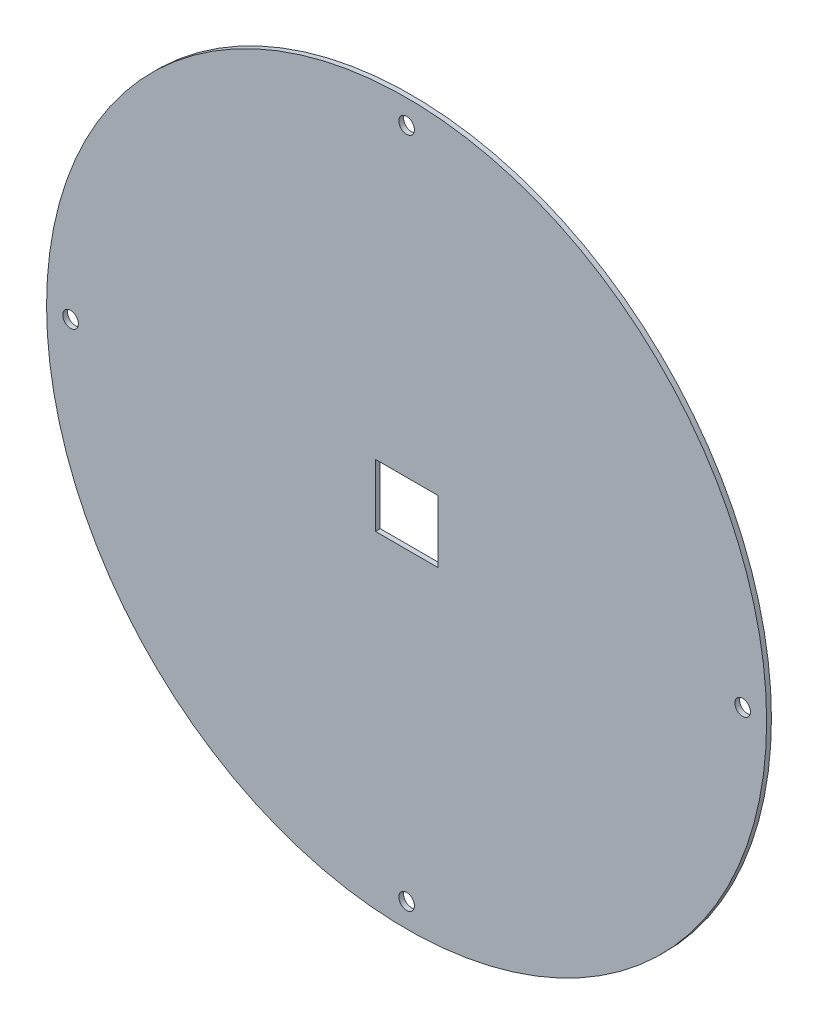
from build123d import *

# Parameters (mm, degrees)
CROQUIS1_R              = 150
CROQUIS1_R_2            = 3.25
SALIENTE_EXTRUIR1_DEPTH = 2
CROQUIS2_W              = 26
CROQUIS2_H              = 26
CORTAR_EXTRUIR1_DEPTH   = 213.141462237


with BuildPart() as part:
    # Croquis1 → Saliente-Extruir1 (new body)
    with BuildSketch(Plane.XY):
        Circle(CROQUIS1_R)
        with Locations((140, 0)):
            Circle(CROQUIS1_R_2, mode=Mode.SUBTRACT)
        with Locations((0, -140)):
            Circle(CROQUIS1_R_2, mode=Mode.SUBTRACT)
        with Locations((-140, 0)):
            Circle(CROQUIS1_R_2, mode=Mode.SUBTRACT)
        with Locations((0, 140)):
            Circle(CROQUIS1_R_2, mode=Mode.SUBTRACT)
    extrude(amount=SALIENTE_EXTRUIR1_DEPTH)

    # Croquis2 → Cortar-Extruir1 (cut, through all)
    with BuildSketch(Plane.XY.offset(2)):
        Rectangle(CROQUIS2_W, CROQUIS2_H)
    extrude(amount=-CORTAR_EXTRUIR1_DEPTH, mode=Mode.SUBTRACT)


solid = part.part
